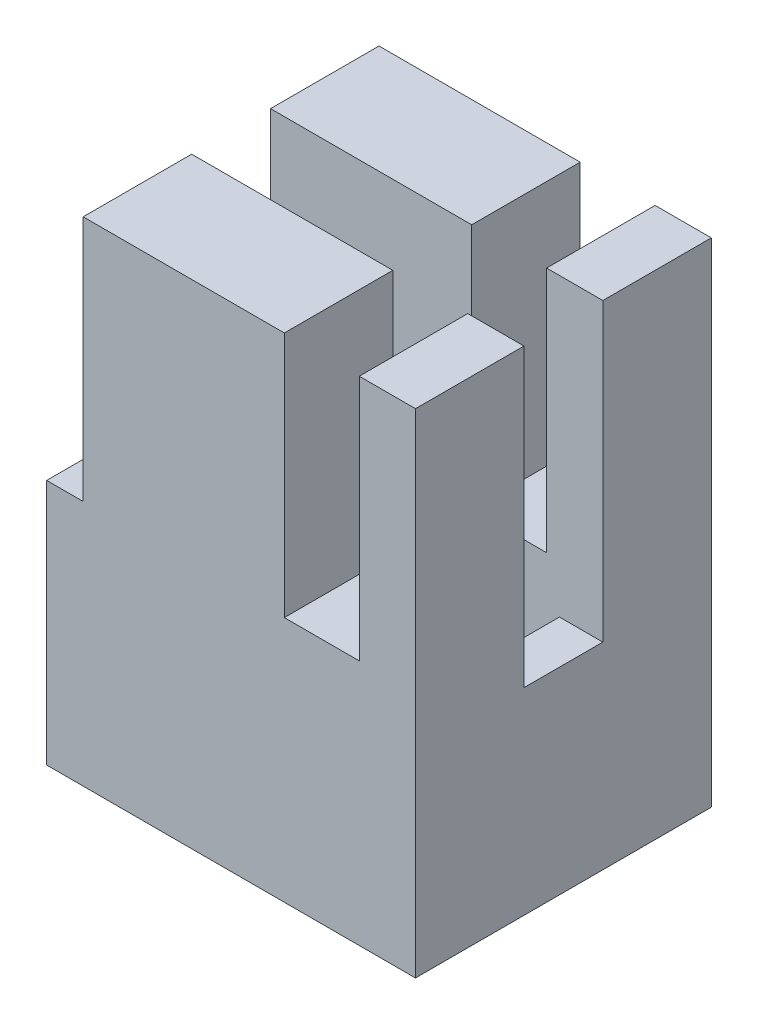
from build123d import *

# Parameters (mm, degrees)
SKETCH1_W           = 47.498
SKETCH1_H           = 38.1
BOSS_EXTRUDE1_DEPTH = 63.5
SKETCH3_W           = 47.498
SKETCH3_H           = 10.16
CUT_EXTRUDE1_DEPTH  = 38.1
SKETCH4_W           = 41.91
SKETCH4_H           = 17.145
CUT_EXTRUDE2_DEPTH  = 19.05
SKETCH5_W           = 40.132
SKETCH5_H           = 10.16
CUT_EXTRUDE3_DEPTH  = 49.770149692
SKETCH6_W           = 9.652
SKETCH6_H           = 38.1
SKETCH6_W_2         = 4.699
CUT_EXTRUDE4_DEPTH  = 31.75


with BuildPart() as part:
    # Sketch1 → Boss-Extrude1 (new body)
    with BuildSketch(Plane(origin=(0, 0, 0), x_dir=(1, 0, 0), z_dir=(0, 1, 0))):
        Rectangle(SKETCH1_W, SKETCH1_H)
    extrude(amount=BOSS_EXTRUDE1_DEPTH)

    # Sketch3 → Cut-Extrude1 (cut)
    with BuildSketch(Plane(origin=(0, 63.5, 0), x_dir=(1, 0, 0), z_dir=(0, 1, 0))):
        Rectangle(SKETCH3_W, SKETCH3_H)
    extrude(amount=-CUT_EXTRUDE1_DEPTH, mode=Mode.SUBTRACT)

    # Sketch4 → Cut-Extrude2 (cut)
    with BuildSketch(Plane.XZ):
        with Locations((-2.794, 0)):
            Rectangle(SKETCH4_W, SKETCH4_H)
    extrude(amount=-CUT_EXTRUDE2_DEPTH, mode=Mode.SUBTRACT)

    # Sketch5 → Cut-Extrude3 (cut, through all)
    with BuildSketch(Plane(origin=(0, 25.4, 0), x_dir=(1, 0, 0), z_dir=(0, 1, 0))):
        with Locations((-1.905, 0)):
            Rectangle(SKETCH5_W, SKETCH5_H)
    extrude(amount=-CUT_EXTRUDE3_DEPTH, mode=Mode.SUBTRACT)

    # Sketch6 → Cut-Extrude4 (cut)
    with BuildSketch(Plane(origin=(0, 63.5, 0), x_dir=(1, 0, 0), z_dir=(0, 1, 0))):
        with Locations((11.684, 0)):
            Rectangle(SKETCH6_W, SKETCH6_H)
        with Locations((-21.3995, 0)):
            Rectangle(SKETCH6_W_2, SKETCH6_H)
    extrude(amount=-CUT_EXTRUDE4_DEPTH, mode=Mode.SUBTRACT)


solid = part.part
